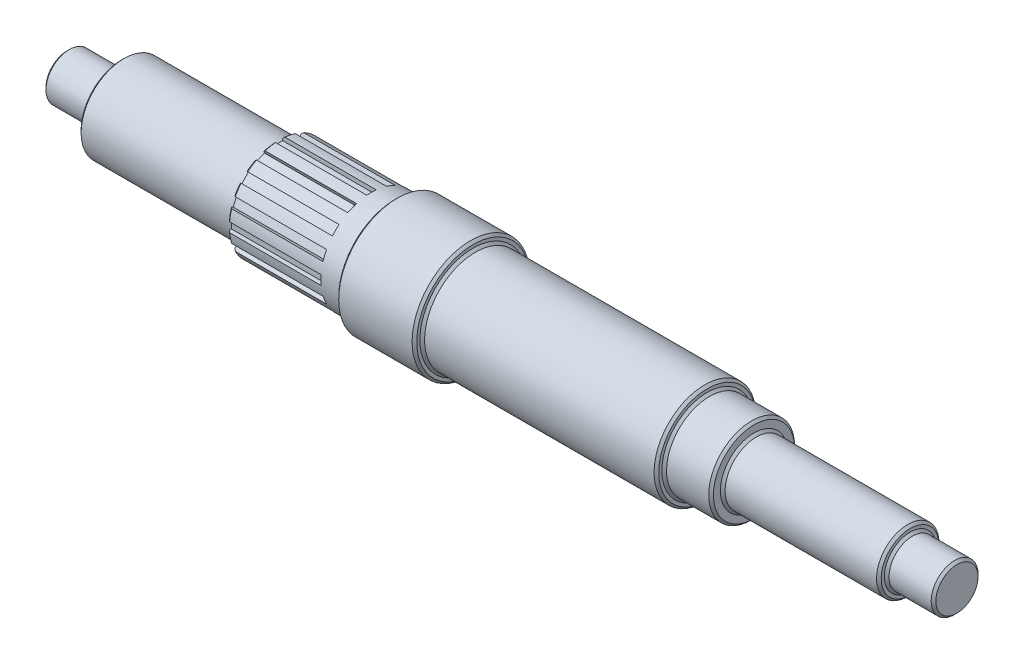
from build123d import *

# Parameters (mm, degrees)
WYTNIJ_WYCI_GNI_CIE1_DEPTH = 22
WYTNIJ_WYCI_GNI_CIE2_DEPTH = 120
SZYK_KO_OWY2_COUNT         = 16
SFAZOWANIE1_SIZE           = 3


with BuildPart() as part:
    # Szkic1 → Obrót1 (revolve)
    with BuildSketch(Plane.XY, mode=Mode.PRIVATE) as obr_t1_sk:
        Polygon((0, 0), (0, 30), (70, 30), (70, 55), (270, 55), (270, 65), (420, 65), (420, 75), (520, 75), (520, 65), (820, 65), (820, 55), (880, 55), (880, 40), (1080, 40), (1080, 30), (1140, 30), (1140, 0), align=None)
    revolve(obr_t1_sk.sketch.rotate(Axis((0, 0, 0), (1, 0, 0)), 180), axis=Axis((0, 0, 0), (1, 0, 0)))

    # Szkic2 → Wytnij-wyciągnięcie1 (cut)
    with BuildSketch(Plane(origin=(0, -55, 0), x_dir=(-1, 0, 0), z_dir=(0, -1, 0))):
        with BuildLine():
            Line((-210, 12), (-130, 12))
            ThreePointArc((-130, 12), (-118, 0), (-130, -12))
            Line((-130, -12), (-210, -12))
            ThreePointArc((-210, -12), (-222, 0), (-210, 12))
        make_face()
    extrude(amount=-WYTNIJ_WYCI_GNI_CIE1_DEPTH, mode=Mode.SUBTRACT)

    # Szkic4 → Wytnij-wyciągnięcie2 (cut)
    with BuildSketch(Plane.ZY.offset(-270)):
        Polygon((0, -65.135380743), (0, -59.348257278), (-6, -59.348257278), (-6, -71.348257278), (0, -71.348257278), align=None)
        Polygon((6, -59.348257278), (0, -59.348257278), (0, -65.135380743), (0, -71.348257278), (6, -71.348257278), align=None)
    wytnij_wyci_gni_cie2 = extrude(amount=-WYTNIJ_WYCI_GNI_CIE2_DEPTH, mode=Mode.SUBTRACT)

    # Szyk kołowy2: Wytnij-wyciągnięcie2 ×16 about axis
    szyk_ko_owy2_axis = Axis((0, 0, 0), (1, 0, 0))
    for i in range(1, SZYK_KO_OWY2_COUNT):
        add(wytnij_wyci_gni_cie2.rotate(szyk_ko_owy2_axis, i * 360 / SZYK_KO_OWY2_COUNT), mode=Mode.SUBTRACT)

    # Sfazowanie1
    sfazowanie1_edges = [part.edges().sort_by_distance(p)[0] for p in [
        (1140, 30, 0),
        (1080, 30, 0),
        (1080, 40, 0),
        (880, 40, 0),
        (880, 55, 0),
        (820, 55, 0),
        (820, 65, 0),
        (520, 65, 0),
        (520, 75, 0),
        (420, 75, 0),
        (420, 65, 0),
        (270, -63.751043226, 12.680870931),
        (270, 55, 0),
        (70, 55, 0),
        (70, 30, 0),
        (0, 30, 0),
        (270, -54.0455248, 36.112065146),
        (270, -36.112065146, 54.0455248),
        (270, -12.680870931, 63.751043226),
        (270, 12.680870931, 63.751043226),
        (270, 36.112065146, 54.0455248),
        (270, 54.0455248, 36.112065146),
        (270, 63.751043226, 12.680870931),
        (270, 63.751043226, -12.680870931),
        (270, 54.0455248, -36.112065146),
        (270, 36.112065146, -54.0455248),
        (270, 12.680870931, -63.751043226),
        (270, -12.680870931, -63.751043226),
        (270, -36.112065146, -54.0455248),
        (270, -54.0455248, -36.112065146),
        (270, -63.751043226, -12.680870931),
    ]]
    chamfer(sfazowanie1_edges, length=SFAZOWANIE1_SIZE)


solid = part.part
